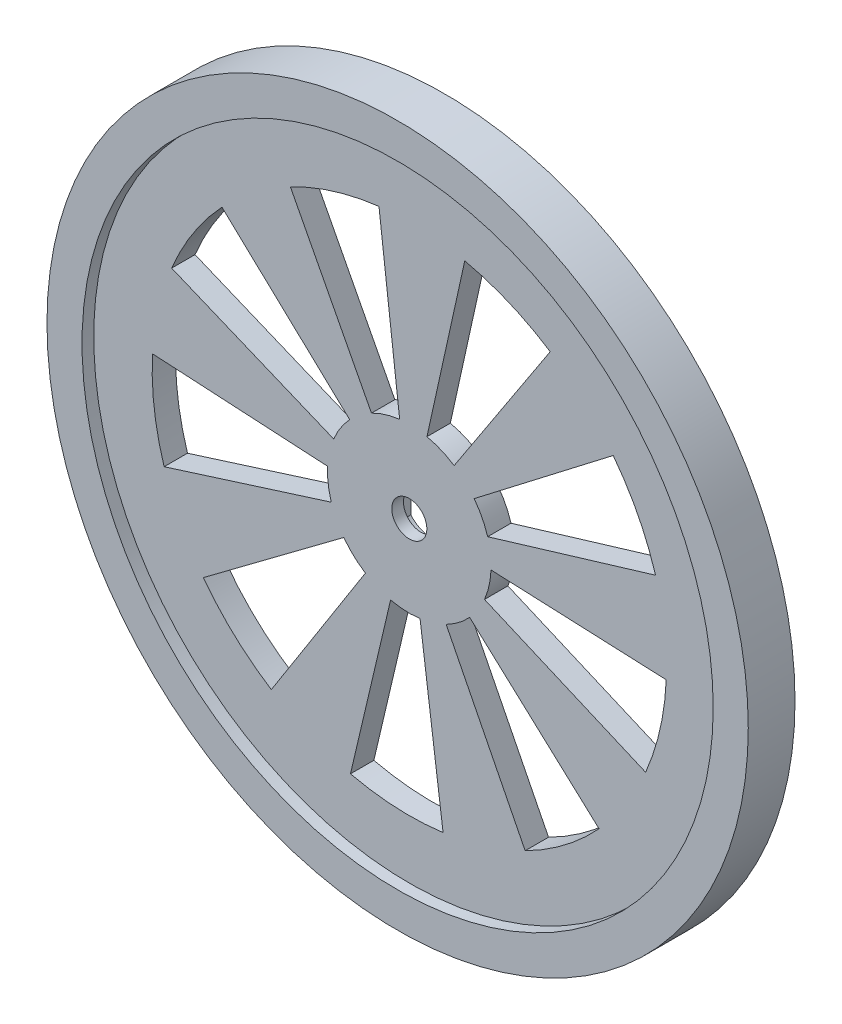
from build123d import *

# Parameters (mm, degrees)
BOSS_EXTRU_1_START      = -2
ESQUISSE1_R             = 30
BOSS_EXTRU_1_DEPTH      = 4
BOSS_EXTRU_2_DEPTH      = 2
ENL_V_MAT_EXTRU_1_DEPTH = 12
ESQUISSE2_3_R           = 27
ENL_V_MAT_EXTRU_2_DEPTH = 1
ENL_V_START             = -3
ESQUISSE2_4_R           = 27
ENL_V_MAT_EXTRU_3_DEPTH = 1


with BuildPart() as part:
    # Esquisse1 → Boss.-Extru.1 (new body)
    with BuildSketch(Plane.XY.offset(BOSS_EXTRU_1_START)):
        with Locations((8.02441701, -11.2)):
            Circle(ESQUISSE1_R)
        with BuildLine():
            ThreePointArc((8.02441701, -13.7), (9.053011579, -13.478594569), (9.89941701, -12.853594569))
            Line((9.89941701, -12.853594569), (9.89941701, -9.546405431))
            ThreePointArc((9.89941701, -9.546405431), (9.053011579, -8.921405431), (8.02441701, -8.7))
            ThreePointArc((8.02441701, -8.7), (6.99582244, -8.921405431), (6.14941701, -9.546405431))
            Line((6.14941701, -9.546405431), (6.14941701, -12.853594569))
            ThreePointArc((6.14941701, -12.853594569), (6.99582244, -13.478594569), (8.02441701, -13.7))
        make_face(mode=Mode.SUBTRACT)
    extrude(amount=BOSS_EXTRU_1_DEPTH)

    # Esquisse1<3> → Boss.-Extru.2 (add)
    with BuildSketch(Plane.XY):
        with BuildLine():
            ThreePointArc((6.14941701, -12.853594569), (6.99582244, -13.478594569), (8.02441701, -13.7))
            ThreePointArc((8.02441701, -13.7), (9.053011579, -13.478594569), (9.89941701, -12.853594569))
            Line((9.89941701, -12.853594569), (9.89941701, -9.546405431))
            ThreePointArc((9.89941701, -9.546405431), (9.053011579, -8.921405431), (8.02441701, -8.7))
            ThreePointArc((8.02441701, -8.7), (6.99582244, -8.921405431), (6.14941701, -9.546405431))
            Line((6.14941701, -9.546405431), (6.14941701, -12.853594569))
        make_face()
        with BuildLine():
            ThreePointArc((8.02441701, -9.7), (6.52441701, -11.2), (8.02441701, -12.7))
            ThreePointArc((8.02441701, -12.7), (9.52441701, -11.2), (8.02441701, -9.7))
        make_face(mode=Mode.SUBTRACT)
    extrude(amount=BOSS_EXTRU_2_DEPTH)

    # Esquisse2 → Enlèv. mat.-Extru.1 (cut)
    with BuildSketch(Plane.XY.offset(2)):
        with BuildLine():
            ThreePointArc((11.17793162, -17.449427622), (12.252818192, -16.778586151), (13.189167721, -15.924970909))
            Line((13.189167721, -15.924970909), (24.256490673, -26.049908572))
            ThreePointArc((24.256490673, -26.049908572), (21.313677868, -28.732699331), (17.935462929, -30.84105824))
            Line((17.935462929, -30.84105824), (11.17793162, -17.449427622))
        make_face()
        with BuildLine():
            ThreePointArc((14.457203996, -13.960299184), (14.849406296, -12.755481033), (15.017998348, -11.499699945))
            Line((15.017998348, -11.499699945), (30.004244075, -12.141914112))
            ThreePointArc((30.004244075, -12.141914112), (29.474383338, -16.088654674), (28.241747539, -19.875226006))
            Line((28.241747539, -19.875226006), (14.457203996, -13.960299184))
        make_face()
        with BuildLine():
            ThreePointArc((6.423094711, -18.014379421), (7.677714181, -18.19140881), (8.943692835, -18.139375473))
            Line((8.943692835, -18.139375473), (10.913569605, -33.009465772))
            ThreePointArc((10.913569605, -33.009465772), (6.934779549, -33.172999117), (2.991689784, -32.616621038))
            Line((2.991689784, -32.616621038), (6.423094711, -18.014379421))
        make_face()
        with BuildLine():
            ThreePointArc((2.417534301, -15.390807356), (3.264836277, -16.332873586), (4.268078575, -17.106769131))
            Line((4.268078575, -17.106769131), (-3.781218072, -29.764131553))
            ThreePointArc((-3.781218072, -29.764131553), (-6.934265292, -27.331888414), (-9.59721436, -24.371108833))
            Line((-9.59721436, -24.371108833), (2.417534301, -15.390807356))
        make_face()
        with BuildLine():
            ThreePointArc((1.035496625, -10.806309953), (1.079019095, -12.072609766), (1.350096815, -13.310319865))
            Line((1.350096815, -13.310319865), (-12.952017889, -17.832433863))
            ThreePointArc((-12.952017889, -17.832433863), (-13.803976437, -13.942487836), (-13.940761343, -9.962688424))
            Line((-13.940761343, -9.962688424), (1.035496625, -10.806309953))
        make_face()
        with BuildLine():
            ThreePointArc((2.923652469, -6.406024499), (2.143030786, -7.404042138), (1.555103651, -8.526428482))
            Line((1.555103651, -8.526428482), (-12.30771069, -2.797346657))
            ThreePointArc((-12.30771069, -2.797346657), (-10.459939693, 0.73015328), (-8.00655726, 3.866780147))
            Line((-8.00655726, 3.866780147), (2.923652469, -6.406024499))
        make_face()
        with BuildLine():
            ThreePointArc((7.198512731, -4.248893461), (5.959008456, -4.511645381), (4.787174106, -4.993530925))
            Line((4.787174106, -4.993530925), (-2.149774974, 8.306045665))
            ThreePointArc((-2.149774974, 8.306045665), (1.533132983, 9.820543087), (5.428717849, 10.646334838))
            Line((5.428717849, 10.646334838), (7.198512731, -4.248893461))
        make_face()
        with BuildLine():
            ThreePointArc((11.859822784, -5.344262425), (10.741413742, -4.748804083), (9.533986494, -4.364709225))
            Line((9.533986494, -4.364709225), (12.768778245, 10.282342434))
            ThreePointArc((12.768778245, 10.282342434), (16.563549598, 9.075187167), (20.078549443, 7.203746664))
            Line((20.078549443, 7.203746664), (11.859822784, -5.344262425))
        make_face()
        with BuildLine():
            ThreePointArc((14.726503849, -9.17959608), (14.252506061, -8.004549052), (13.574454543, -6.934196045))
            Line((13.574454543, -6.934196045), (25.467392114, 2.206812429))
            ThreePointArc((25.467392114, 2.206812429), (27.598411173, -1.157154163), (29.088118504, -4.850159109))
            Line((29.088118504, -4.850159109), (14.726503849, -9.17959608))
        make_face()
    extrude(amount=-ENL_V_MAT_EXTRU_1_DEPTH, mode=Mode.SUBTRACT)

    # Esquisse2<3> → Enlèv. mat.-Extru.2 (cut)
    with BuildSketch(Plane.XY.offset(2)):
        with Locations((8.02441701, -11.2)):
            Circle(ESQUISSE2_3_R)
        with BuildLine():
            Line((-9.59721436, -24.371108833), (2.417534301, -15.390807356))
            ThreePointArc((2.417534301, -15.390807356), (3.264836277, -16.332873586), (4.268078575, -17.106769131))
            Line((4.268078575, -17.106769131), (-3.781218072, -29.764131553))
            ThreePointArc((-3.781218072, -29.764131553), (-6.934265292, -27.331888414), (-9.59721436, -24.371108833))
        make_face(mode=Mode.SUBTRACT)
        with BuildLine():
            Line((-13.940761343, -9.962688424), (1.035496625, -10.806309953))
            ThreePointArc((1.035496625, -10.806309953), (1.079019095, -12.072609766), (1.350096815, -13.310319865))
            Line((1.350096815, -13.310319865), (-12.952017889, -17.832433863))
            ThreePointArc((-12.952017889, -17.832433863), (-13.803976437, -13.942487836), (-13.940761343, -9.962688424))
        make_face(mode=Mode.SUBTRACT)
        with BuildLine():
            Line((-8.00655726, 3.866780147), (2.923652469, -6.406024499))
            ThreePointArc((2.923652469, -6.406024499), (2.143030786, -7.404042138), (1.555103651, -8.526428482))
            Line((1.555103651, -8.526428482), (-12.30771069, -2.797346657))
            ThreePointArc((-12.30771069, -2.797346657), (-10.459939693, 0.73015328), (-8.00655726, 3.866780147))
        make_face(mode=Mode.SUBTRACT)
        with BuildLine():
            Line((5.428717849, 10.646334838), (7.198512731, -4.248893461))
            ThreePointArc((7.198512731, -4.248893461), (5.959008456, -4.511645381), (4.787174106, -4.993530925))
            Line((4.787174106, -4.993530925), (-2.149774974, 8.306045665))
            ThreePointArc((-2.149774974, 8.306045665), (1.533132983, 9.820543087), (5.428717849, 10.646334838))
        make_face(mode=Mode.SUBTRACT)
        with BuildLine():
            Line((20.078549443, 7.203746664), (11.859822784, -5.344262425))
            ThreePointArc((11.859822784, -5.344262425), (10.741413742, -4.748804083), (9.533986494, -4.364709225))
            Line((9.533986494, -4.364709225), (12.768778245, 10.282342434))
            ThreePointArc((12.768778245, 10.282342434), (16.563549598, 9.075187167), (20.078549443, 7.203746664))
        make_face(mode=Mode.SUBTRACT)
        with BuildLine():
            Line((29.088118504, -4.850159109), (14.726503849, -9.17959608))
            ThreePointArc((14.726503849, -9.17959608), (14.252506061, -8.004549052), (13.574454543, -6.934196045))
            Line((13.574454543, -6.934196045), (25.467392114, 2.206812429))
            ThreePointArc((25.467392114, 2.206812429), (27.598411173, -1.157154163), (29.088118504, -4.850159109))
        make_face(mode=Mode.SUBTRACT)
        with BuildLine():
            Line((28.241747539, -19.875226006), (14.457203996, -13.960299184))
            ThreePointArc((14.457203996, -13.960299184), (14.849406296, -12.755481033), (15.017998348, -11.499699945))
            Line((15.017998348, -11.499699945), (30.004244075, -12.141914112))
            ThreePointArc((30.004244075, -12.141914112), (29.474383338, -16.088654674), (28.241747539, -19.875226006))
        make_face(mode=Mode.SUBTRACT)
        with BuildLine():
            Line((17.935462929, -30.84105824), (11.17793162, -17.449427622))
            ThreePointArc((11.17793162, -17.449427622), (12.252818192, -16.778586151), (13.189167721, -15.924970909))
            Line((13.189167721, -15.924970909), (24.256490673, -26.049908572))
            ThreePointArc((24.256490673, -26.049908572), (21.313677868, -28.732699331), (17.935462929, -30.84105824))
        make_face(mode=Mode.SUBTRACT)
        with BuildLine():
            Line((2.991689784, -32.616621038), (6.423094711, -18.014379421))
            ThreePointArc((6.423094711, -18.014379421), (7.677714181, -18.19140881), (8.943692835, -18.139375473))
            Line((8.943692835, -18.139375473), (10.913569605, -33.009465772))
            ThreePointArc((10.913569605, -33.009465772), (6.934779549, -33.172999117), (2.991689784, -32.616621038))
        make_face(mode=Mode.SUBTRACT)
    extrude(amount=-ENL_V_MAT_EXTRU_2_DEPTH, mode=Mode.SUBTRACT)

    # Esquisse2<4> → Enlèv. mat.-Extru.3 (cut)
    with BuildSketch(Plane.XY.offset(2).offset(ENL_V_START)):
        with Locations((8.02441701, -11.2)):
            Circle(ESQUISSE2_4_R)
        with BuildLine():
            Line((-9.59721436, -24.371108833), (2.417534301, -15.390807356))
            ThreePointArc((2.417534301, -15.390807356), (3.264836277, -16.332873586), (4.268078575, -17.106769131))
            Line((4.268078575, -17.106769131), (-3.781218072, -29.764131553))
            ThreePointArc((-3.781218072, -29.764131553), (-6.934265292, -27.331888414), (-9.59721436, -24.371108833))
        make_face(mode=Mode.SUBTRACT)
        with BuildLine():
            Line((-13.940761343, -9.962688424), (1.035496625, -10.806309953))
            ThreePointArc((1.035496625, -10.806309953), (1.079019095, -12.072609766), (1.350096815, -13.310319865))
            Line((1.350096815, -13.310319865), (-12.952017889, -17.832433863))
            ThreePointArc((-12.952017889, -17.832433863), (-13.803976437, -13.942487836), (-13.940761343, -9.962688424))
        make_face(mode=Mode.SUBTRACT)
        with BuildLine():
            Line((-8.00655726, 3.866780147), (2.923652469, -6.406024499))
            ThreePointArc((2.923652469, -6.406024499), (2.143030786, -7.404042138), (1.555103651, -8.526428482))
            Line((1.555103651, -8.526428482), (-12.30771069, -2.797346657))
            ThreePointArc((-12.30771069, -2.797346657), (-10.459939693, 0.73015328), (-8.00655726, 3.866780147))
        make_face(mode=Mode.SUBTRACT)
        with BuildLine():
            Line((5.428717849, 10.646334838), (7.198512731, -4.248893461))
            ThreePointArc((7.198512731, -4.248893461), (5.959008456, -4.511645381), (4.787174106, -4.993530925))
            Line((4.787174106, -4.993530925), (-2.149774974, 8.306045665))
            ThreePointArc((-2.149774974, 8.306045665), (1.533132983, 9.820543087), (5.428717849, 10.646334838))
        make_face(mode=Mode.SUBTRACT)
        with BuildLine():
            Line((20.078549443, 7.203746664), (11.859822784, -5.344262425))
            ThreePointArc((11.859822784, -5.344262425), (10.741413742, -4.748804083), (9.533986494, -4.364709225))
            Line((9.533986494, -4.364709225), (12.768778245, 10.282342434))
            ThreePointArc((12.768778245, 10.282342434), (16.563549598, 9.075187167), (20.078549443, 7.203746664))
        make_face(mode=Mode.SUBTRACT)
        with BuildLine():
            Line((29.088118504, -4.850159109), (14.726503849, -9.17959608))
            ThreePointArc((14.726503849, -9.17959608), (14.252506061, -8.004549052), (13.574454543, -6.934196045))
            Line((13.574454543, -6.934196045), (25.467392114, 2.206812429))
            ThreePointArc((25.467392114, 2.206812429), (27.598411173, -1.157154163), (29.088118504, -4.850159109))
        make_face(mode=Mode.SUBTRACT)
        with BuildLine():
            Line((28.241747539, -19.875226006), (14.457203996, -13.960299184))
            ThreePointArc((14.457203996, -13.960299184), (14.849406296, -12.755481033), (15.017998348, -11.499699945))
            Line((15.017998348, -11.499699945), (30.004244075, -12.141914112))
            ThreePointArc((30.004244075, -12.141914112), (29.474383338, -16.088654674), (28.241747539, -19.875226006))
        make_face(mode=Mode.SUBTRACT)
        with BuildLine():
            Line((17.935462929, -30.84105824), (11.17793162, -17.449427622))
            ThreePointArc((11.17793162, -17.449427622), (12.252818192, -16.778586151), (13.189167721, -15.924970909))
            Line((13.189167721, -15.924970909), (24.256490673, -26.049908572))
            ThreePointArc((24.256490673, -26.049908572), (21.313677868, -28.732699331), (17.935462929, -30.84105824))
        make_face(mode=Mode.SUBTRACT)
        with BuildLine():
            Line((2.991689784, -32.616621038), (6.423094711, -18.014379421))
            ThreePointArc((6.423094711, -18.014379421), (7.677714181, -18.19140881), (8.943692835, -18.139375473))
            Line((8.943692835, -18.139375473), (10.913569605, -33.009465772))
            ThreePointArc((10.913569605, -33.009465772), (6.934779549, -33.172999117), (2.991689784, -32.616621038))
        make_face(mode=Mode.SUBTRACT)
    extrude(amount=-ENL_V_MAT_EXTRU_3_DEPTH, mode=Mode.SUBTRACT)


solid = part.part
